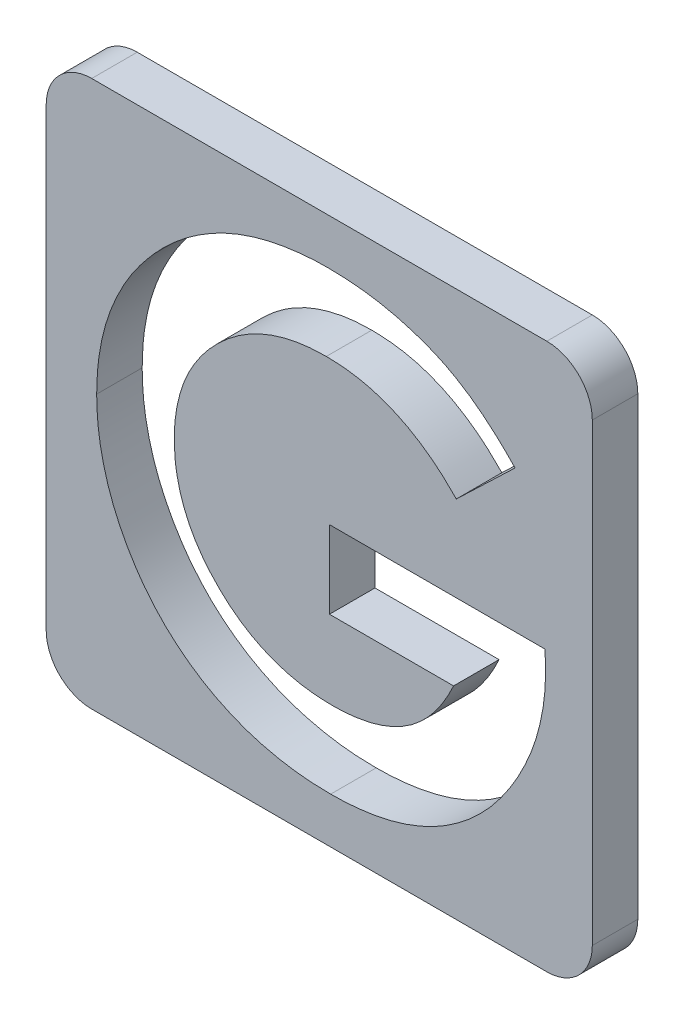
from build123d import *

# Parameters (mm, degrees)
BOSS_EXTRUDE1_DEPTH = 10
CUT_EXTRUDE20_DEPTH = 10


with BuildPart() as part:
    # Sketch1 → Boss-Extrude1 (new body)
    with BuildSketch(Plane.XY):
        with BuildLine():
            Line((-50, 60), (50, 60))
            ThreePointArc((50, 60), (57.071067812, 57.071067812), (60, 50))
            Line((60, 50), (60, -50))
            ThreePointArc((60, -50), (57.071067812, -57.071067812), (50, -60))
            Line((50, -60), (-50, -60))
            ThreePointArc((-50, -60), (-57.071067812, -57.071067812), (-60, -50))
            Line((-60, -50), (-60, 50))
            ThreePointArc((-60, 50), (-57.071067812, 57.071067812), (-50, 60))
        make_face()
    extrude(amount=BOSS_EXTRUDE1_DEPTH)

    # Sketch2 → Cut-Extrude20 (cut)
    with BuildSketch(Plane.XY.offset(10)):
        with BuildLine():
            Line((43.025841346, 32.389823718), (30.123197115, 20.0390625))
            add(Edge.make_bspline(
                [(30.123197115, 20.0390625), (29.101672257, 21.061811325), (27.097271839, 23.068613369), (23.819325693, 25.680604146), (20.424368315, 27.901312672), (16.901225536, 29.727334557), (13.244989599, 31.143755892), (9.462875821, 32.156967391), (5.548731191, 32.7579203), (2.899029992, 32.842051661), (1.55849359, 32.884615385)],
                knots=[0, 0, 0, 0, 1.075575784, 2.110457258, 3.113929901, 4.09197124, 5.059417775, 6.02750972, 7.002078037, 8, 8, 8, 8], degree=3))
            add(Edge.make_bspline(
                [(1.55849359, 32.884615385), (0.396289515, 32.854791176), (-1.885800065, 32.796228727), (-5.239110912, 32.351509499), (-8.443404835, 31.608626028), (-11.513820243, 30.579485021), (-14.431611188, 29.240247299), (-17.213683889, 27.611582431), (-19.842917451, 25.681030991), (-22.298608552, 23.485189523), (-24.534523201, 21.087773984), (-26.486594752, 18.521691616), (-28.149340344, 15.834772023), (-29.518119077, 13.01326852), (-30.559610844, 10.06151156), (-31.303099679, 6.981643968), (-31.775030209, 3.782616261), (-31.830751107, 1.600206429), (-31.858974359, 0.494791667)],
                knots=[0, 0, 0, 0, 1.075001177, 2.110859044, 3.123021556, 4.114053297, 5.101481495, 6.087880186, 7.091499647, 8.114004866, 9.131394192, 10.11971144, 11.092043119, 12.050101265, 13.015322563, 13.981809771, 14.977764287, 16, 16, 16, 16], degree=3))
            add(Edge.make_bspline(
                [(-31.858974359, 0.494791667), (-31.83264906, -0.648882984), (-31.780784616, -2.90207861), (-31.282567998, -6.208740054), (-30.514979525, -9.389986642), (-29.39143466, -12.422214259), (-28.0086912, -15.346960195), (-26.255144671, -18.107569332), (-24.210333942, -20.746199204), (-21.877912803, -23.216909745), (-19.340840935, -25.494310256), (-16.593109559, -27.458854559), (-13.718321506, -29.153832231), (-10.670077564, -30.496199757), (-7.501286227, -31.573973822), (-4.179806851, -32.333897032), (-0.713118606, -32.800107284), (1.652171532, -32.856165602), (2.852564103, -32.884615385)],
                knots=[0, 0, 0, 0, 1.022067601, 2.013613092, 2.983553406, 3.943623673, 4.90013463, 5.87121881, 6.861774014, 7.881098904, 8.905697761, 9.905387765, 10.89678721, 11.884561068, 12.87834324, 13.885584958, 14.926927371, 16, 16, 16, 16], degree=3))
            add(Edge.make_bspline(
                [(2.852564103, -32.884615385), (3.633375016, -32.877570263), (5.166280575, -32.863739121), (7.414791803, -32.639220794), (9.56832549, -32.318245747), (11.635221676, -31.893312898), (13.594610257, -31.291956666), (15.47362031, -30.588744605), (17.261242491, -29.758814157), (18.947784497, -28.773531178), (20.558346969, -27.669149395), (22.077854726, -26.405501787), (23.532961722, -25.011078956), (24.906665222, -23.468846061), (26.175714886, -21.765013702), (27.380767856, -19.930892086), (28.508026478, -17.948278664), (29.174093857, -16.548257493), (29.514222756, -15.833333333)],
                knots=[0, 0, 0, 0, 1.109579412, 2.178351274, 3.208885622, 4.204702371, 5.174744997, 6.119429583, 7.05542196, 7.97267548, 8.893247984, 9.828544973, 10.778894627, 11.756245826, 12.760884819, 13.796418446, 14.874735809, 16, 16, 16, 16], degree=3))
            Line((29.514222756, -15.833333333), (2.243589744, -15.833333333))
            Line((2.243589744, -15.833333333), (2.243589744, 1.217948718))
            Line((2.243589744, 1.217948718), (49.610376603, 1.217948718))
            Line((49.610376603, 1.217948718), (49.743589744, -2.835536859))
            add(Edge.make_bspline(
                [(49.743589744, -2.835536859), (49.726472847, -3.876574804), (49.692269599, -5.95679287), (49.379687785, -9.05388319), (48.861900774, -12.109897034), (48.154036366, -15.12176501), (47.266903196, -18.104261414), (46.135530703, -21.028826361), (44.810700427, -23.915293277), (43.326322097, -26.751396909), (41.658307942, -29.472715457), (39.862445782, -32.049444886), (37.964336859, -34.477125435), (35.922698088, -36.721933428), (33.769321141, -38.80272625), (31.499967076, -40.711498835), (29.106609302, -42.449866244), (26.601926388, -44.03251371), (23.971651757, -45.419610834), (21.230246649, -46.626201315), (18.381850215, -47.650933134), (15.419108562, -48.490990308), (12.347851627, -49.139161247), (9.168013616, -49.583612912), (5.877848125, -49.885622812), (3.646198469, -49.91893663), (2.510016026, -49.935897436)],
                knots=[0, 0, 0, 0, 1.006889344, 2.011981806, 3.007738725, 4.003571281, 5.003404394, 6.015442001, 7.03424805, 8.074616296, 9.110249922, 10.119753985, 11.111721717, 12.089233633, 13.052717867, 14.006597561, 14.955430184, 15.912305663, 16.870361111, 17.829300583, 18.807640451, 19.796414044, 20.806216501, 21.841577364, 22.90109906, 24, 24, 24, 24], degree=3))
            add(Edge.make_bspline(
                [(2.510016026, -49.935897436), (1.297786391, -49.919148326), (-1.105214309, -49.885946594), (-4.658372904, -49.574989776), (-8.108452155, -49.061775621), (-11.456312597, -48.351504768), (-14.709727285, -47.467515954), (-17.863106347, -46.357900887), (-20.910000278, -45.037978679), (-23.85953309, -43.54270137), (-26.674006547, -41.846926658), (-29.347112957, -39.980390143), (-31.864262001, -37.931085264), (-34.251237083, -35.733317811), (-36.452269248, -33.333066461), (-38.549382353, -30.808135004), (-40.44097845, -28.065919025), (-42.208390563, -25.195321967), (-43.778573599, -22.19754677), (-45.151721242, -19.128038823), (-46.322740771, -16.004570602), (-47.246117975, -12.812598182), (-47.995813786, -9.574378679), (-48.532235209, -6.275829811), (-48.83517745, -2.917364496), (-48.885118988, -0.660301834), (-48.91025641, 0.475761218)],
                knots=[0, 0, 0, 0, 1.084149091, 2.14910686, 3.187506334, 4.202448172, 5.208724393, 6.201130722, 7.189831603, 8.176984443, 9.156919086, 10.126598231, 11.090766514, 12.05840148, 13.026036446, 14.001772938, 14.991905635, 16.003017641, 17.015720547, 18.016462227, 19.009322657, 19.99686681, 20.986544154, 21.980959929, 22.983742515, 24, 24, 24, 24], degree=3))
            add(Edge.make_bspline(
                [(-48.91025641, 0.475761218), (-48.876592035, 2.025593992), (-48.810114873, 5.086054225), (-48.194435478, 9.594131562), (-47.234683024, 13.955246578), (-45.857341624, 18.15351638), (-44.089887361, 22.194724133), (-41.957357822, 26.088356769), (-39.413429836, 29.830275694), (-37.444254854, 32.14704321), (-36.4453125, 33.322315705)],
                knots=[0, 0, 0, 0, 1.034044851, 2.041932006, 3.031217818, 4.011390712, 4.986069675, 5.97149666, 6.970960976, 8, 8, 8, 8], degree=3))
            add(Edge.make_bspline(
                [(-36.4453125, 33.322315705), (-35.825078952, 34.002246466), (-34.593924689, 35.351898801), (-32.625926838, 37.227268178), (-30.608020011, 38.990184776), (-28.512255874, 40.603267051), (-26.349651476, 42.101826149), (-24.113982457, 43.457770387), (-21.816976621, 44.714273743), (-19.440720102, 45.807174398), (-16.997652934, 46.787051002), (-14.476955156, 47.616164385), (-11.897506276, 48.350561775), (-9.236465188, 48.909249832), (-6.520714756, 49.374482609), (-3.730977675, 49.686305981), (-0.874856146, 49.914850314), (1.056880807, 49.928826235), (2.034254808, 49.935897436)],
                knots=[0, 0, 0, 0, 1.020590567, 2.025856924, 3.013483481, 3.991664875, 4.957826714, 5.930500614, 6.890802512, 7.860442893, 8.829981142, 9.809047939, 10.802672283, 11.803273349, 12.823572789, 13.857849586, 14.916166035, 16, 16, 16, 16], degree=3))
            add(Edge.make_bspline(
                [(2.034254808, 49.935897436), (3.055927959, 49.920141479), (5.088682381, 49.888792909), (8.111051578, 49.671881266), (11.091422928, 49.337237729), (14.017236856, 48.835253312), (16.898312407, 48.216202044), (19.719736444, 47.423044151), (22.499915266, 46.521873915), (24.309801151, 45.803394427), (25.213341346, 45.444711538)],
                knots=[0, 0, 0, 0, 1.03180557, 2.052914215, 3.058998889, 4.059601663, 5.049854447, 6.033765722, 7.018406786, 8, 8, 8, 8], degree=3))
            add(Edge.make_bspline(
                [(25.213341346, 45.444711538), (25.973558652, 45.113223986), (27.519819621, 44.438987476), (29.769438752, 43.205440158), (32.024554321, 41.837911379), (34.260832481, 40.286401114), (36.474865772, 38.553811407), (38.689771056, 36.667508217), (40.882937788, 34.60549617), (42.302289454, 33.137946044), (43.025841346, 32.389823718)],
                knots=[0, 0, 0, 0, 0.894392155, 1.819168899, 2.76525314, 3.739198753, 4.75366411, 5.797420238, 6.877176959, 8, 8, 8, 8], degree=3))
        make_face()
    extrude(amount=-CUT_EXTRUDE20_DEPTH, mode=Mode.SUBTRACT)


solid = part.part
